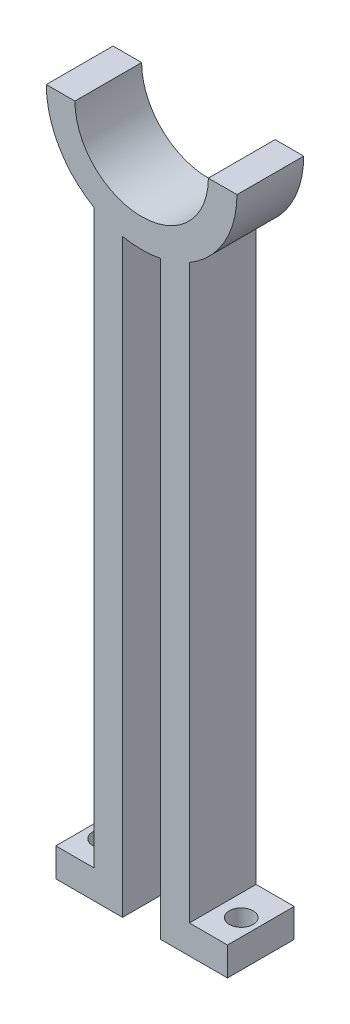
from build123d import *

# Parameters (mm, degrees)
BOSS_EXTRUDE1_DEPTH = 7
SKETCH3_R           = 1.25
CUT_EXTRUDE1_DEPTH  = 10


with BuildPart() as part:
    # Sketch2 → Boss-Extrude1 (new body)
    with BuildSketch(Plane.XY):
        with BuildLine():
            Line((-5.004882759, -8.657433139), (-5.004882759, -68.657433139))
            Line((-5.004882759, -68.657433139), (-9.004882759, -68.657433139))
            Line((-9.004882759, -68.657433139), (-9.004882759, -71.657433139))
            Line((-9.004882759, -71.657433139), (-2.004882759, -71.657433139))
            Line((-2.004882759, -71.657433139), (-2.004882759, -9.796961015))
            ThreePointArc((-2.004882759, -9.796961015), (0, -10), (2.004882759, -9.796961015))
            Line((2.004882759, -9.796961015), (2.004882759, -71.657433139))
            Line((2.004882759, -71.657433139), (9.004882759, -71.657433139))
            Line((9.004882759, -71.657433139), (9.004882759, -68.657433139))
            Line((9.004882759, -68.657433139), (5.004882759, -68.657433139))
            Line((5.004882759, -68.657433139), (5.004882759, -8.657433139))
            ThreePointArc((5.004882759, -8.657433139), (8.661663454, -4.997558024), (10, 0))
            Line((10, 0), (7, 0))
            ThreePointArc((7, 0), (0, -7), (-7, 0))
            Line((-7, 0), (-10, 0))
            ThreePointArc((-10, 0), (-8.661663454, -4.997558024), (-5.004882759, -8.657433139))
        make_face()
    extrude(amount=BOSS_EXTRUDE1_DEPTH)

    # Sketch3 → Cut-Extrude1 (cut)
    with BuildSketch(Plane(origin=(0, -68.657433139, 0), x_dir=(1, 0, 0), z_dir=(0, 1, 0))):
        with Locations(Location((-7.084526396, -3.795336707, 0), (0, 0, 270))):
            Circle(SKETCH3_R)
        with Locations(Location((7.239366758, -3.795336707, 0), (0, 0, 270))):
            Circle(SKETCH3_R)
    extrude(amount=-CUT_EXTRUDE1_DEPTH, mode=Mode.SUBTRACT)


solid = part.part
